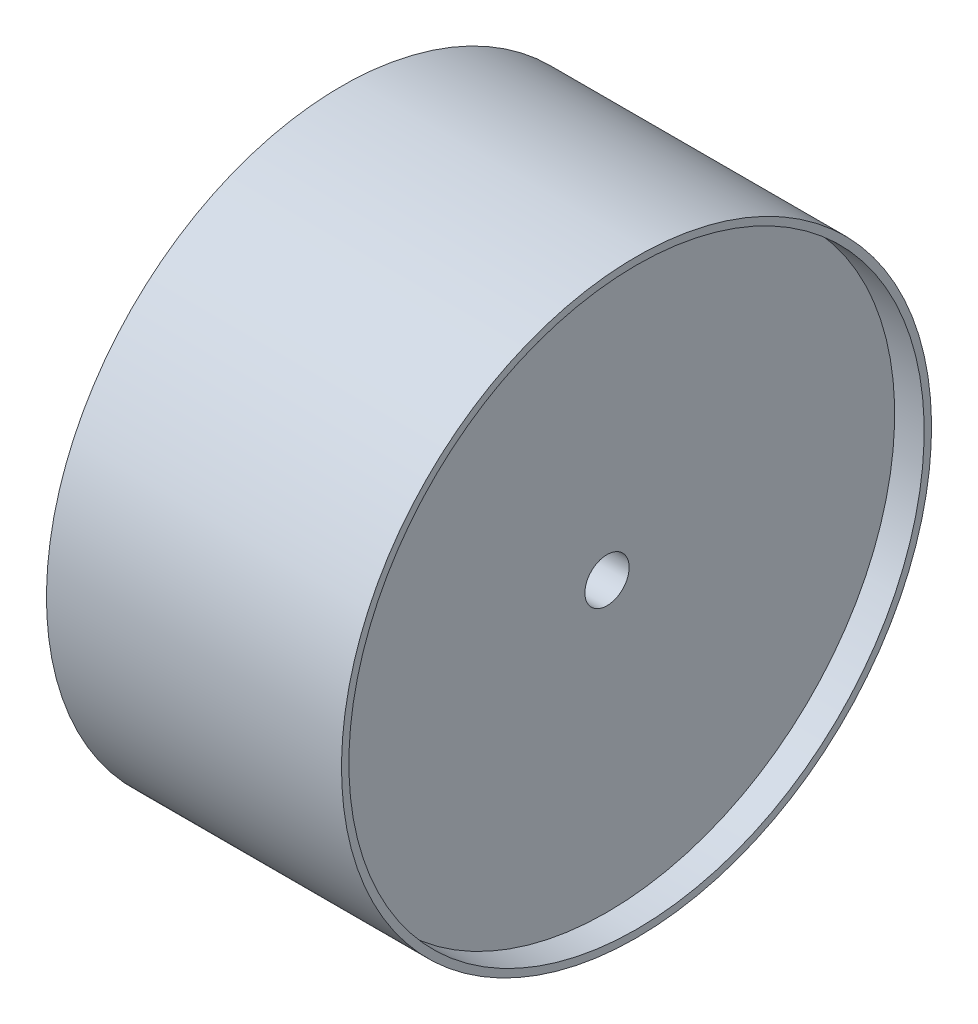
from build123d import *

# Parameters (mm, degrees)
SKETCH_1_W          = 60
SKETCH_1_H          = 70
SKETCH_3_R          = 7.5
CUT_EXTRUDE_1_DEPTH = 17


with BuildPart() as part:
    # Эскиз1 → Повернуть1 (revolve)
    with BuildSketch(Plane.XY, mode=Mode.PRIVATE) as revolve_1_sk:
        Polygon((-40, 80), (40, 80), (40, 78), (32, 78), (32, 6), (30, 6), (-30, 6), (-32, 6), (-32, 78), (-40, 78), align=None)
        with Locations((0, 43)):
            Rectangle(SKETCH_1_W, SKETCH_1_H, mode=Mode.SUBTRACT)
    revolve(revolve_1_sk.sketch.rotate(Axis((-118.179588976, 0, 0), (1, 0, 0)), 180), axis=Axis((-118.179588976, 0, 0), (1, 0, 0)))

    # Эскиз3 → Вырез-Вытянуть1 (cut)
    with BuildSketch(Plane.ZY.offset(32)):
        with Locations(Location((0, -49.984788399, 0), (0, 0, 270))):
            Circle(SKETCH_3_R)
    extrude(amount=-CUT_EXTRUDE_1_DEPTH, mode=Mode.SUBTRACT)


solid = part.part
